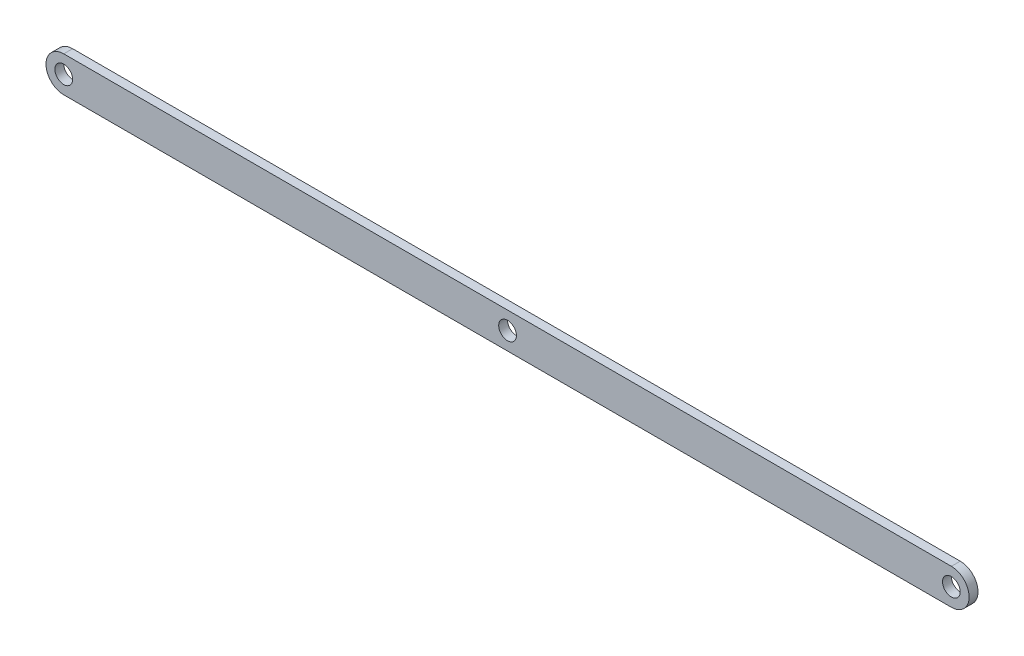
from build123d import *

# Parameters (mm, degrees)
SKETCH1_R           = 5
BOSS_EXTRUDE1_DEPTH = 5


with BuildPart() as part:
    # Sketch1 → Boss-Extrude1 (new body)
    with BuildSketch(Plane.XY):
        with BuildLine():
            Line((-250, 10), (250, 10))
            ThreePointArc((250, 10), (260, 0), (250, -10))
            Line((250, -10), (-250, -10))
            ThreePointArc((-250, -10), (-260, 0), (-250, 10))
        make_face()
        with Locations((-250, 0)):
            Circle(SKETCH1_R, mode=Mode.SUBTRACT)
        Circle(SKETCH1_R, mode=Mode.SUBTRACT)
        with Locations((250, 0)):
            Circle(SKETCH1_R, mode=Mode.SUBTRACT)
    extrude(amount=BOSS_EXTRUDE1_DEPTH)


solid = part.part
